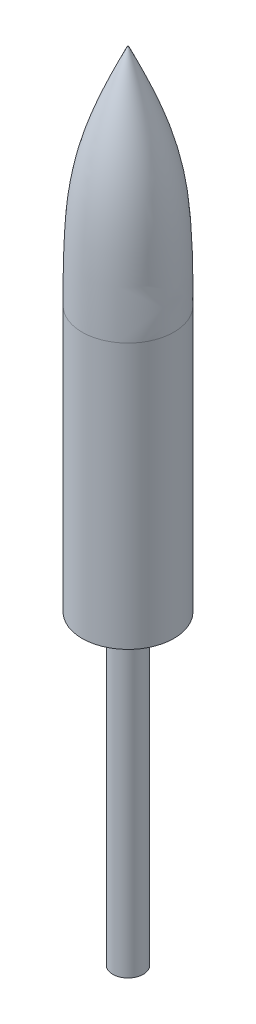
from build123d import *

# Parameters (mm, degrees)
SKETCH4_R           = 1
BOSS_EXTRUDE1_DEPTH = 20


with BuildPart() as part:
    # Sketch3 → Revolve4 (revolve)
    with BuildSketch(Plane.XY, mode=Mode.PRIVATE) as revolve4_sk:
        with BuildLine():
            Line((0, 0), (3, 0))
            Line((3, 0), (3, 17.327098578))
            add(Edge.make_bspline(
                [(0.037503181, 31.986949556), (2.794271205, 26.050457709), (3, 24.051077685), (3, 17.327098578)],
                knots=[0, 0, 0, 0, 1, 1, 1, 1], degree=3))
            add(Edge.make_bspline(
                [(0, 32), (0.020617145, 31.999929678), (0.037503181, 31.986949556)],
                knots=[0, 0, 0, 1, 1, 1], degree=2))
            Line((0, 32), (0, 0))
        make_face()
    revolve(revolve4_sk.sketch.rotate(Axis((0, 44.735961968, 0), (0, -1, 0)), 90), axis=Axis((0, 44.735961968, 0), (0, -1, 0)))

    # Sketch4 → Boss-Extrude1 (add)
    with BuildSketch(Plane.XZ):
        with Locations(Location((0, 0, 0), (0, 0, 90))):
            Circle(SKETCH4_R)
    extrude(amount=BOSS_EXTRUDE1_DEPTH)


solid = part.part
